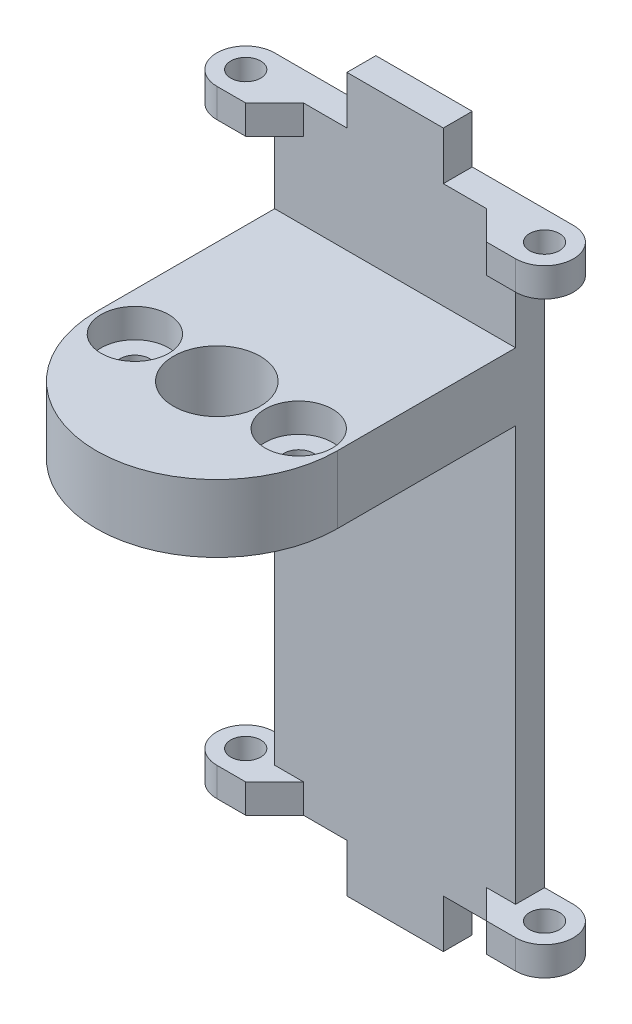
from build123d import *

# Parameters (mm, degrees)
SKETCH11_R          = 1.55
SKETCH11_R_2        = 4.5
BOSS_EXTRUDE1_DEPTH = 7
BOSS_EXTRUDE2_DEPTH = 3
SKETCH13_R          = 3.5
CUT_EXTRUDE1_DEPTH  = 3
SKETCH14_R          = 1.55
BOSS_EXTRUDE3_DEPTH = 3
BOSS_EXTRUDE4_START = -3
SKETCH15_R          = 1.55
BOSS_EXTRUDE4_DEPTH = 3


with BuildPart() as part:
    # Sketch11 → Boss-Extrude1 (new body)
    with BuildSketch(Plane(origin=(0, 0, 51.65), x_dir=(1, 0, 0), z_dir=(0, -1, 0))):
        with BuildLine():
            Line((12.5, 90), (12.5, 71.5))
            Line((12.5, 71.5), (-12.5, 71.5))
            Line((-12.5, 71.5), (-12.5, 90))
            ThreePointArc((-12.5, 90), (0, 102.5), (12.5, 90))
        make_face()
        with Locations(Location((-8.5, 90, 0), (0, 0, 270))):
            Circle(SKETCH11_R, mode=Mode.SUBTRACT)
        with Locations(Location((8.5, 90, 0), (0, 0, 270))):
            Circle(SKETCH11_R, mode=Mode.SUBTRACT)
        with Locations(Location((0, 90, 0), (0, 0, 270))):
            Circle(SKETCH11_R_2, mode=Mode.SUBTRACT)
    extrude(amount=BOSS_EXTRUDE1_DEPTH)

    # Sketch12 → Boss-Extrude2 (add)
    with BuildSketch(Plane(origin=(0, 0, 123.15), x_dir=(-1, 0, 0), z_dir=(0, 0, -1))):
        Polygon((-12.5, 0), (-12.5, 11), (-5, 11), (-5, 16), (5, 16), (5, 11), (12.5, 11), (12.5, 0), (12.5, -7), (12.5, -53), (5, -53), (5, -58), (-5, -58), (-5, -53), (-12.5, -53), (-12.5, -7), align=None)
    extrude(amount=BOSS_EXTRUDE2_DEPTH)

    # Sketch13 → Cut-Extrude1 (cut)
    with BuildSketch(Plane(origin=(0, 0, 0), x_dir=(1, 0, 0), z_dir=(0, 1, 0))):
        with Locations(Location((-8.5, -141.65, 0), (0, 0, 270))):
            Circle(SKETCH13_R)
        with Locations(Location((8.5, -141.65, 0), (0, 0, 270))):
            Circle(SKETCH13_R)
    extrude(amount=-CUT_EXTRUDE1_DEPTH, mode=Mode.SUBTRACT)

    # Sketch14 → Boss-Extrude3 (add)
    with BuildSketch(Plane(origin=(0, 11, 0), x_dir=(1, 0, 0), z_dir=(0, 1, 0))):
        with BuildLine():
            Line((15.5, -120.15), (-15.5, -120.15))
            ThreePointArc((-15.5, -120.15), (-18.5, -123.15), (-15.5, -126.15))
            Line((-15.5, -126.15), (-12.5, -126.15))
            Line((-12.5, -126.15), (-9.5, -123.15))
            Line((-9.5, -123.15), (9.5, -123.15))
            Line((9.5, -123.15), (12.5, -126.15))
            Line((12.5, -126.15), (15.5, -126.15))
            ThreePointArc((15.5, -126.15), (18.5, -123.15), (15.5, -120.15))
        make_face()
        with Locations(Location((-15.5, -123.15, 0), (0, 0, 270))):
            Circle(SKETCH14_R, mode=Mode.SUBTRACT)
        with Locations(Location((15.5, -123.15, 0), (0, 0, 270))):
            Circle(SKETCH14_R, mode=Mode.SUBTRACT)
    extrude(amount=-BOSS_EXTRUDE3_DEPTH)

    # Sketch15 → Boss-Extrude4 (add)
    with BuildSketch(Plane(origin=(0, -53, 0), x_dir=(-1, 0, 0), z_dir=(0, -1, 0)).offset(BOSS_EXTRUDE4_START)):
        with BuildLine():
            Line((15.5, -120.15), (-15.5, -120.15))
            ThreePointArc((-15.5, -120.15), (-18.5, -123.15), (-15.5, -126.15))
            Line((-15.5, -126.15), (-12.5, -126.15))
            Line((-12.5, -126.15), (-9.5, -123.15))
            Line((-9.5, -123.15), (9.5, -123.15))
            Line((9.5, -123.15), (12.5, -126.15))
            Line((12.5, -126.15), (15.5, -126.15))
            ThreePointArc((15.5, -126.15), (18.5, -123.15), (15.5, -120.15))
        make_face()
        with Locations(Location((15.5, -123.15, 0), (0, 0, 270))):
            Circle(SKETCH15_R, mode=Mode.SUBTRACT)
        with Locations(Location((-15.5, -123.15, 0), (0, 0, 270))):
            Circle(SKETCH15_R, mode=Mode.SUBTRACT)
    extrude(amount=BOSS_EXTRUDE4_DEPTH)


solid = part.part
